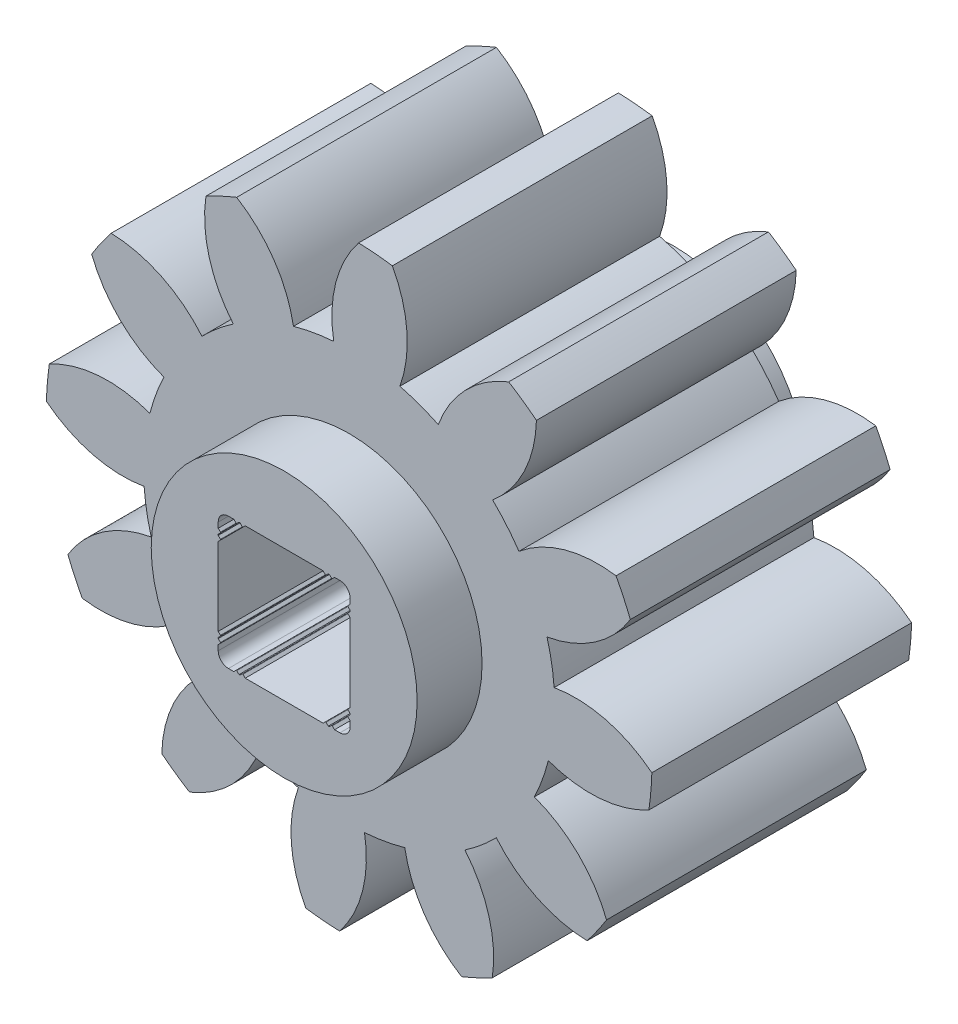
from build123d import *

# Parameters (mm, degrees)
SKETCH1_W            = 7.404
SKETCH1_H            = 6.35
CUT_EXTRUDE1_DEPTH   = 13.245853666
CUT_EXTRUDE2_DEPTH   = 13.245853666
CUT_EXTRUDE3_DEPTH   = 13.245853666
CUT_EXTRUDE4_DEPTH   = 13.245853666
CUT_EXTRUDE5_DEPTH   = 13.245853666
CUT_EXTRUDE6_DEPTH   = 13.245853666
CUT_EXTRUDE7_DEPTH   = 13.245853666
CUT_EXTRUDE8_DEPTH   = 13.245853666
CUT_EXTRUDE9_DEPTH   = 13.243663808
CUT_EXTRUDE10_DEPTH  = 13.243663808
CUT_EXTRUDE11_DEPTH  = 13.243663808
CUT_EXTRUDE12_DEPTH  = 13.241473559
SKETCH14_R           = 3.25
BOSS_EXTRUDE1_DEPTH  = 1.5875
BOSS_EXTRUDE2_START  = 1.5875
SKETCH15_R           = 3.25
BOSS_EXTRUDE2_DEPTH  = 1.5875
CUT_EXTRUDE13_DEPTH  = 15.151211959
DRAFT1_ANGLE         = 44.905292199
DRAFT2_ANGLE         = 45
DRAFT3_ANGLE         = 45
DRAFT4_ANGLE         = 44.905292199
DRAFT5_ANGLE         = 44.905292199
DRAFT6_ANGLE         = 45
DRAFT7_ANGLE         = 45
DRAFT8_ANGLE         = 44.905292199
DRAFT9_ANGLE         = 45
DRAFT10_ANGLE        = 44.810245375
DRAFT11_ANGLE        = 44.905292199
DRAFT12_ANGLE        = 44.905292199
DRAFT13_ANGLE        = 44.905292199
DRAFT14_ANGLE        = 44.905292199
DRAFT15_ANGLE        = 45
DRAFT16_ANGLE        = 44.810245375
FILLET1_R            = 0.0127
CHAMFER1_SIZE        = 0.017960512
CHAMFER2_SIZE        = 0.017990274
CHAMFER2_EDGE_2_SIZE = 0.017990274
CHAMFER2_EDGE_3_SIZE = 0.017990274
CHAMFER2_EDGE_4_SIZE = 0.017990274
FILLET2_R            = 0.25


with BuildPart() as part:
    # Sketch1 → Revolve1 (revolve)
    with BuildSketch(Plane(origin=(0, 0, 0), x_dir=(1, 0, 0), z_dir=(0, 1, 0))):
        with Locations((3.702, 0)):
            Rectangle(SKETCH1_W, SKETCH1_H)
    revolve(axis=Axis((0, 0, -3.175), (0, 0, 1)))

    # Sketch2 → Cut-Extrude1 (cut, through all)
    with BuildSketch(Plane(origin=(0, 0, -3.175), x_dir=(-1, 0, 0), z_dir=(0, 0, -1))):
        with BuildLine():
            ThreePointArc((1.057001873, -7.328162323), (2.532317141, -6.957484164), (3.900741532, -6.293125734))
            ThreePointArc((3.900741532, -6.293125734), (2.850773823, -5.595435975), (2.180140266, -4.527983952))
            ThreePointArc((2.180140266, -4.527983952), (1.71882223, -4.722425266), (1.240447645, -4.870004095))
            ThreePointArc((1.240447645, -4.870004095), (1.41285747, -6.118794727), (1.057001873, -7.328162323))
        make_face()
    extrude(amount=-CUT_EXTRUDE1_DEPTH, mode=Mode.SUBTRACT)

    # Sketch3 → Cut-Extrude2 (cut, through all)
    with BuildSketch(Plane(origin=(0, 0, -3.175), x_dir=(-1, 0, 0), z_dir=(0, 0, -1))):
        with BuildLine():
            ThreePointArc((-2.748690687, -6.874875672), (-1.285691107, -7.291516603), (0.231578393, -7.400377521))
            ThreePointArc((0.231578393, -7.400377521), (-0.328875436, -6.271176611), (-0.375935122, -5.011419263))
            ThreePointArc((-0.375935122, -5.011419263), (-0.872668917, -4.949151363), (-1.360742875, -4.837771086))
            ThreePointArc((-1.360742875, -4.837771086), (-1.835826903, -6.005460409), (-2.748690687, -6.874875672))
        make_face()
    extrude(amount=-CUT_EXTRUDE2_DEPTH, mode=Mode.SUBTRACT)

    # Sketch4 → Cut-Extrude3 (cut, through all)
    with BuildSketch(Plane(origin=(0, 0, -3.175), x_dir=(-1, 0, 0), z_dir=(0, 0, -1))):
        with BuildLine():
            ThreePointArc((-5.817873798, -4.579471636), (-4.759199462, -5.671793057), (-3.499635989, -6.524704127))
            ThreePointArc((-3.499635989, -6.524704127), (-3.420402788, -5.266560539), (-2.831278997, -4.15204883))
            ThreePointArc((-2.831278997, -4.15204883), (-3.230329132, -3.849756349), (-3.597323441, -3.509261221))
            ThreePointArc((-3.597323441, -3.509261221), (-4.592602939, -4.282967824), (-5.817873798, -4.579471636))
        make_face()
    extrude(amount=-CUT_EXTRUDE3_DEPTH, mode=Mode.SUBTRACT)

    # Sketch5 → Cut-Extrude4 (cut, through all)
    with BuildSketch(Plane(origin=(0, 0, -3.175), x_dir=(-1, 0, 0), z_dir=(0, 0, -1))):
        with BuildLine():
            ThreePointArc((-7.328162323, -1.057001873), (-6.957484164, -2.532317141), (-6.293125734, -3.900741532))
            ThreePointArc((-6.293125734, -3.900741532), (-5.595435975, -2.850773823), (-4.527983952, -2.180140266))
            ThreePointArc((-4.527983952, -2.180140266), (-4.722425266, -1.71882223), (-4.870004095, -1.240447645))
            ThreePointArc((-4.870004095, -1.240447645), (-6.118794727, -1.41285747), (-7.328162323, -1.057001873))
        make_face()
    extrude(amount=-CUT_EXTRUDE4_DEPTH, mode=Mode.SUBTRACT)

    # Sketch6 → Cut-Extrude5 (cut, through all)
    with BuildSketch(Plane(origin=(0, 0, -3.175), x_dir=(-1, 0, 0), z_dir=(0, 0, -1))):
        with BuildLine():
            ThreePointArc((-6.874875672, 2.748690687), (-7.291516603, 1.285691107), (-7.400377521, -0.231578393))
            ThreePointArc((-7.400377521, -0.231578393), (-6.271176611, 0.328875436), (-5.011419263, 0.375935122))
            ThreePointArc((-5.011419263, 0.375935122), (-4.949151363, 0.872668917), (-4.837771086, 1.360742875))
            ThreePointArc((-4.837771086, 1.360742875), (-6.005460409, 1.835826903), (-6.874875672, 2.748690687))
        make_face()
    extrude(amount=-CUT_EXTRUDE5_DEPTH, mode=Mode.SUBTRACT)

    # Sketch7 → Cut-Extrude6 (cut, through all)
    with BuildSketch(Plane(origin=(0, 0, -3.175), x_dir=(-1, 0, 0), z_dir=(0, 0, -1))):
        with BuildLine():
            ThreePointArc((-4.579471636, 5.817873798), (-5.671793057, 4.759199462), (-6.524704127, 3.499635989))
            ThreePointArc((-6.524704127, 3.499635989), (-5.266560539, 3.420402788), (-4.15204883, 2.831278997))
            ThreePointArc((-4.15204883, 2.831278997), (-3.849756349, 3.230329132), (-3.509261221, 3.597323441))
            ThreePointArc((-3.509261221, 3.597323441), (-4.282967824, 4.592602939), (-4.579471636, 5.817873798))
        make_face()
    extrude(amount=-CUT_EXTRUDE6_DEPTH, mode=Mode.SUBTRACT)

    # Sketch8 → Cut-Extrude7 (cut, through all)
    with BuildSketch(Plane(origin=(0, 0, -3.175), x_dir=(-1, 0, 0), z_dir=(0, 0, -1))):
        with BuildLine():
            ThreePointArc((-1.057001873, 7.328162323), (-2.532317141, 6.957484164), (-3.900741532, 6.293125734))
            ThreePointArc((-3.900741532, 6.293125734), (-2.850773823, 5.595435975), (-2.180140266, 4.527983952))
            ThreePointArc((-2.180140266, 4.527983952), (-1.71882223, 4.722425266), (-1.240447645, 4.870004095))
            ThreePointArc((-1.240447645, 4.870004095), (-1.41285747, 6.118794727), (-1.057001873, 7.328162323))
        make_face()
    extrude(amount=-CUT_EXTRUDE7_DEPTH, mode=Mode.SUBTRACT)

    # Sketch9 → Cut-Extrude8 (cut, through all)
    with BuildSketch(Plane(origin=(0, 0, -3.175), x_dir=(-1, 0, 0), z_dir=(0, 0, -1))):
        with BuildLine():
            ThreePointArc((2.748690687, 6.874875672), (1.285691107, 7.291516603), (-0.231578393, 7.400377521))
            ThreePointArc((-0.231578393, 7.400377521), (0.328875436, 6.271176611), (0.375935122, 5.011419263))
            ThreePointArc((0.375935122, 5.011419263), (0.872668917, 4.949151363), (1.360742875, 4.837771086))
            ThreePointArc((1.360742875, 4.837771086), (1.835826903, 6.005460409), (2.748690687, 6.874875672))
        make_face()
    extrude(amount=-CUT_EXTRUDE8_DEPTH, mode=Mode.SUBTRACT)

    # Sketch10 → Cut-Extrude9 (cut, through all)
    with BuildSketch(Plane(origin=(0, 0, -3.175), x_dir=(-1, 0, 0), z_dir=(0, 0, -1))):
        with BuildLine():
            ThreePointArc((5.817873798, 4.579471636), (4.759199462, 5.671793057), (3.499635989, 6.524704127))
            ThreePointArc((3.499635989, 6.524704127), (3.420402788, 5.266560539), (2.831278997, 4.15204883))
            ThreePointArc((2.831278997, 4.15204883), (3.230329132, 3.849756349), (3.597323441, 3.509261221))
            ThreePointArc((3.597323441, 3.509261221), (4.592602939, 4.282967824), (5.817873798, 4.579471636))
        make_face()
    extrude(amount=-CUT_EXTRUDE9_DEPTH, mode=Mode.SUBTRACT)

    # Sketch11 → Cut-Extrude10 (cut, through all)
    with BuildSketch(Plane(origin=(0, 0, -3.175), x_dir=(-1, 0, 0), z_dir=(0, 0, -1))):
        with BuildLine():
            ThreePointArc((7.328162323, 1.057001873), (6.957484164, 2.532317141), (6.293125734, 3.900741532))
            ThreePointArc((6.293125734, 3.900741532), (5.595435975, 2.850773823), (4.527983952, 2.180140266))
            ThreePointArc((4.527983952, 2.180140266), (4.722425266, 1.71882223), (4.870004095, 1.240447645))
            ThreePointArc((4.870004095, 1.240447645), (6.118794727, 1.41285747), (7.328162323, 1.057001873))
        make_face()
    extrude(amount=-CUT_EXTRUDE10_DEPTH, mode=Mode.SUBTRACT)

    # Sketch12 → Cut-Extrude11 (cut, through all)
    with BuildSketch(Plane(origin=(0, 0, -3.175), x_dir=(-1, 0, 0), z_dir=(0, 0, -1))):
        with BuildLine():
            ThreePointArc((6.874875672, -2.748690687), (7.291516603, -1.285691107), (7.400377521, 0.231578393))
            ThreePointArc((7.400377521, 0.231578393), (6.271176611, -0.328875436), (5.011419263, -0.375935122))
            ThreePointArc((5.011419263, -0.375935122), (4.949151363, -0.872668917), (4.837771086, -1.360742875))
            ThreePointArc((4.837771086, -1.360742875), (6.005460409, -1.835826903), (6.874875672, -2.748690687))
        make_face()
    extrude(amount=-CUT_EXTRUDE11_DEPTH, mode=Mode.SUBTRACT)

    # Sketch13 → Cut-Extrude12 (cut, through all)
    with BuildSketch(Plane(origin=(0, 0, -3.175), x_dir=(-1, 0, 0), z_dir=(0, 0, -1))):
        with BuildLine():
            ThreePointArc((4.579471636, -5.817873798), (5.671793057, -4.759199462), (6.524704127, -3.499635989))
            ThreePointArc((6.524704127, -3.499635989), (5.266560539, -3.420402788), (4.15204883, -2.831278997))
            ThreePointArc((4.15204883, -2.831278997), (3.849756349, -3.230329132), (3.509261221, -3.597323441))
            ThreePointArc((3.509261221, -3.597323441), (4.282967824, -4.592602939), (4.579471636, -5.817873798))
        make_face()
    extrude(amount=-CUT_EXTRUDE12_DEPTH, mode=Mode.SUBTRACT)

    # Sketch14 → Boss-Extrude1 (add)
    with BuildSketch(Plane.XY.offset(3.175)):
        Circle(SKETCH14_R)
    extrude(amount=BOSS_EXTRUDE1_DEPTH)

    # Sketch15 → Boss-Extrude2 (add)
    with BuildSketch(Plane(origin=(0, 0, -3.175), x_dir=(-1, 0, 0), z_dir=(0, 0, -1)).offset(BOSS_EXTRUDE2_START)):
        with Locations(Location((0, 0, 0), (0, 0, 180))):
            Circle(SKETCH15_R)
    extrude(amount=-BOSS_EXTRUDE2_DEPTH)

    # Sketch16 → Cut-Extrude13 (cut, through all)
    with BuildSketch(Plane(origin=(0, 0, -4.7625), x_dir=(-1, 0, 0), z_dir=(0, 0, -1))):
        Polygon((1.4855, 1.2315), (1.6125, 1.2315), (1.6125, 1.6125), (1.2315, 1.6125), (1.2315, 1.4855), (1.0918, 1.6252), (0.9521, 1.4855), (0.9521, 1.6125), (-0.9521, 1.6125), (-0.9521, 1.485079452), (-1.0918, 1.625242055), (-1.2315, 1.485079452), (-1.2315, 1.6125), (-1.6125, 1.6125), (-1.6125, 1.2315), (-1.485079452, 1.2315), (-1.625242055, 1.0918), (-1.485079452, 0.9521), (-1.6125, 0.9521), (-1.6125, -0.9521), (-1.4855, -0.9521), (-1.6252, -1.0918), (-1.4855, -1.2315), (-1.6125, -1.2315), (-1.6125, -1.6125), (-1.2315, -1.6125), (-1.2315, -1.4855), (-1.0918, -1.6252), (-0.9521, -1.4855), (-0.9521, -1.6125), (0.9521, -1.6125), (0.9521, -1.485079452), (1.0918, -1.625242055), (1.2315, -1.485079452), (1.2315, -1.6125), (1.6125, -1.6125), (1.6125, -1.2315), (1.485079452, -1.2315), (1.625242055, -1.0918), (1.485079452, -0.9521), (1.6125, -0.9521), (1.6125, 0.9521), (1.4855, 0.9521), (1.6252, 1.0918), align=None)
    extrude(amount=-CUT_EXTRUDE13_DEPTH, mode=Mode.SUBTRACT)

    # Draft1
    draft1_faces = [part.faces().sort_by_distance(p)[0] for p in [
        (-1.548789726, -0.9521, 0),
    ]]
    draft(draft1_faces, Plane(origin=(-1.6125, -0.9521, 4.7625), x_dir=(0, 0, 1), z_dir=(1, 0, 0)), DRAFT1_ANGLE)

    # Draft2
    draft2_faces = [part.faces().sort_by_distance(p)[0] for p in [
        (-1.549, 0.9521, 0),
    ]]
    draft(draft2_faces, Plane(origin=(-1.6125, -0.9521, 4.7625), x_dir=(0, 0, 1), z_dir=(1, 0, 0)), DRAFT2_ANGLE)

    # Draft3
    draft3_faces = [part.faces().sort_by_distance(p)[0] for p in [
        (0.9521, -1.549, 0),
    ]]
    draft(draft3_faces, Plane(origin=(0.9521, -1.6125, 4.7625), x_dir=(0, 0, 1), z_dir=(0, 1, 0)), DRAFT3_ANGLE)

    # Draft4
    draft4_faces = [part.faces().sort_by_distance(p)[0] for p in [
        (-0.9521, -1.548789726, 0),
    ]]
    draft(draft4_faces, Plane(origin=(0.9521, -1.6125, 4.7625), x_dir=(0, 0, 1), z_dir=(0, 1, 0)), DRAFT4_ANGLE)

    # Draft5
    draft5_faces = [part.faces().sort_by_distance(p)[0] for p in [
        (1.548789726, 0.9521, 0),
    ]]
    draft(draft5_faces, Plane(origin=(1.6125, 0.9521, 4.7625), x_dir=(0, -1, 0), z_dir=(-1, 0, 0)), DRAFT5_ANGLE)

    # Draft6
    draft6_faces = [part.faces().sort_by_distance(p)[0] for p in [
        (1.549, -0.9521, 0),
    ]]
    draft(draft6_faces, Plane(origin=(1.6125, 0.9521, 4.7625), x_dir=(0, -1, 0), z_dir=(-1, 0, 0)), DRAFT6_ANGLE)

    # Draft7
    draft7_faces = [part.faces().sort_by_distance(p)[0] for p in [
        (-0.9521, 1.549, 0),
    ]]
    draft(draft7_faces, Plane(origin=(-0.9521, 1.6125, 4.7625), x_dir=(-1, 0, 0), z_dir=(0, -1, 0)), DRAFT7_ANGLE)

    # Draft8
    draft8_faces = [part.faces().sort_by_distance(p)[0] for p in [
        (0.9521, 1.548789726, 0),
    ]]
    draft(draft8_faces, Plane(origin=(-0.9521, 1.6125, 4.7625), x_dir=(-1, 0, 0), z_dir=(0, -1, 0)), DRAFT8_ANGLE)

    # Draft9
    draft9_faces = [part.faces().sort_by_distance(p)[0] for p in [
        (1.2315, -1.549, 0),
    ]]
    draft(draft9_faces, Plane(origin=(1.6125, -1.6125, 4.7625), x_dir=(0, 0, 1), z_dir=(0, 1, 0)), DRAFT9_ANGLE)

    # Draft10
    draft10_faces = [part.faces().sort_by_distance(p)[0] for p in [
        (1.549, -1.2315, 0),
    ]]
    draft(draft10_faces, Plane(origin=(1.6125, -1.2315, 4.7625), x_dir=(0, 0, -1), z_dir=(-1, 0, 0)), DRAFT10_ANGLE)

    # Draft11
    draft11_faces = [part.faces().sort_by_distance(p)[0] for p in [
        (1.548789726, 1.2315, 0),
    ]]
    draft(draft11_faces, Plane(origin=(1.6125, 1.6125, 4.7625), x_dir=(0, 0, -1), z_dir=(-1, 0, 0)), DRAFT11_ANGLE)

    # Draft12
    draft12_faces = [part.faces().sort_by_distance(p)[0] for p in [
        (1.2315, 1.548789726, 0),
    ]]
    draft(draft12_faces, Plane(origin=(1.2315, 1.6125, 4.7625), x_dir=(-1, 0, 0), z_dir=(0, -1, 0)), DRAFT12_ANGLE)

    # Draft13
    draft13_faces = [part.faces().sort_by_distance(p)[0] for p in [
        (-1.2315, -1.548789726, 0),
    ]]
    draft(draft13_faces, Plane(origin=(-1.2315, -1.6125, 4.7625), x_dir=(0, 0, 1), z_dir=(0, 1, 0)), DRAFT13_ANGLE)

    # Draft14
    draft14_faces = [part.faces().sort_by_distance(p)[0] for p in [
        (-1.548789726, -1.2315, 0),
    ]]
    draft(draft14_faces, Plane(origin=(-1.6125, -1.6125, 4.7625), x_dir=(0, 0, 1), z_dir=(1, 0, 0)), DRAFT14_ANGLE)

    # Draft15
    draft15_faces = [part.faces().sort_by_distance(p)[0] for p in [
        (-1.2315, 1.549, 0),
    ]]
    draft(draft15_faces, Plane(origin=(-1.6125, 1.6125, 4.7625), x_dir=(0, 0, -1), z_dir=(0, -1, 0)), DRAFT15_ANGLE)

    # Draft16
    draft16_faces = [part.faces().sort_by_distance(p)[0] for p in [
        (-1.549, 1.2315, 0),
    ]]
    draft(draft16_faces, Plane(origin=(-1.6125, 1.2315, 4.7625), x_dir=(0, 0, 1), z_dir=(1, 0, 0)), DRAFT16_ANGLE)

    # Fillet1
    fillet1_edges = [part.edges().sort_by_distance(p)[0] for p in [
        (-1.548789697, 1.168210303, 0),
        (-1.549, 1.0156, 0),
        (-1.548789726, -1.0156, 0),
        (-1.548789726, -1.168, 0),
        (-1.168, -1.548789726, 0),
        (-1.0156, -1.548789726, 0),
        (1.0156, -1.549, 0),
        (1.168, -1.549, 0),
        (1.548789697, -1.168210303, 0),
        (1.549, -1.0156, 0),
        (1.548789726, 1.0156, 0),
        (1.548789726, 1.168, 0),
        (1.168, 1.548789726, 0),
        (1.0156, 1.548789726, 0),
        (-1.0156, 1.549, 0),
        (-1.168, 1.549, 0),
    ]]
    fillet(fillet1_edges, radius=FILLET1_R)

    # Chamfer1
    chamfer1_edges = [part.edges().sort_by_distance(p)[0] for p in [
        (-1.6252, 1.0918, 0),
        (1.0918, -1.6252, 0),
        (1.6252, -1.0918, 0),
        (-1.0918, 1.6252, 0),
    ]]
    chamfer(chamfer1_edges, length=CHAMFER1_SIZE)

    # Chamfer2
    chamfer2_edges = [part.edges().sort_by_distance(p)[0] for p in [
        (-1.625242055, -1.0918, 0),
    ]]
    chamfer(chamfer2_edges, length=CHAMFER2_SIZE)

    # Chamfer2 edge 2
    chamfer2_edge_2_edges = [part.edges().sort_by_distance(p)[0] for p in [
        (-1.0918, -1.625242055, 0),
    ]]
    chamfer(chamfer2_edge_2_edges, length=CHAMFER2_EDGE_2_SIZE)

    # Chamfer2 edge 3
    chamfer2_edge_3_edges = [part.edges().sort_by_distance(p)[0] for p in [
        (1.625242055, 1.0918, 0),
    ]]
    chamfer(chamfer2_edge_3_edges, length=CHAMFER2_EDGE_3_SIZE)

    # Chamfer2 edge 4
    chamfer2_edge_4_edges = [part.edges().sort_by_distance(p)[0] for p in [
        (1.0918, 1.625242055, 0),
    ]]
    chamfer(chamfer2_edge_4_edges, length=CHAMFER2_EDGE_4_SIZE)

    # Fillet2
    fillet2_edges = [part.edges().sort_by_distance(p)[0] for p in [
        (-1.6125, -1.6125, 0),
        (1.6125, -1.6125, 0),
        (1.6125, 1.6125, 0),
        (-1.6125, 1.6125, 0),
    ]]
    fillet(fillet2_edges, radius=FILLET2_R)


solid = part.part
